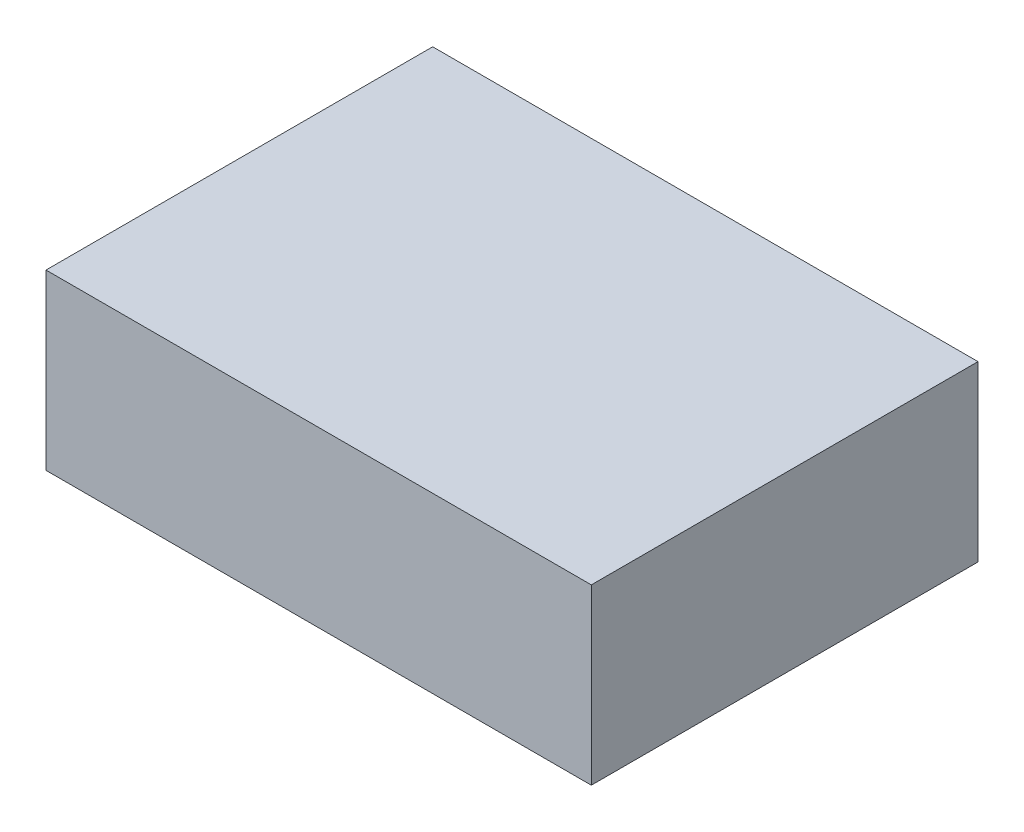
from build123d import *

# Parameters (mm, degrees)
SKETCH1_W           = 109.999999964
SKETCH1_H           = 77.999999956
BOSS_EXTRUDE1_DEPTH = 35


with BuildPart() as part:
    # Sketch1 → Boss-Extrude1 (new body)
    with BuildSketch(Plane(origin=(0, 0, 0), x_dir=(1, 0, 0), z_dir=(0, 1, 0))):
        Rectangle(SKETCH1_W, SKETCH1_H)
    extrude(amount=BOSS_EXTRUDE1_DEPTH)


solid = part.part
